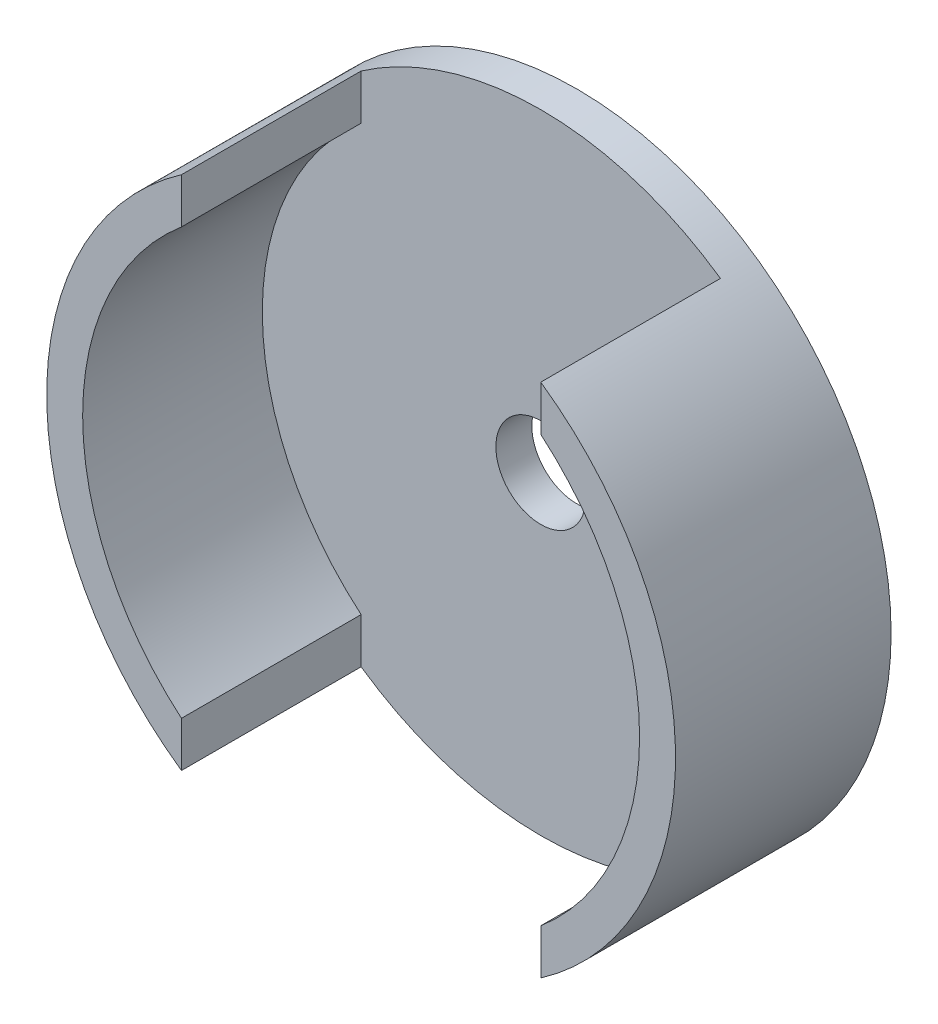
from build123d import *

# Parameters (mm, degrees)
SKETCH1_R               = 17.5
BOSS_EXTRUDE1_DEPTH     = 12
SHELL4_T                = -2
CUT_EXTRUDE1_DEPTH      = 28.504545079
CUT_EXTRUDE1_DEPTH_BACK = 28.504545079
SKETCH3_R               = 2.5
CUT_EXTRUDE2_DEPTH      = 28.504545079
CUT_EXTRUDE2_DEPTH_BACK = 28.504545079
SKETCH4_W               = 20
SKETCH4_H               = 24.94066955


with BuildPart() as part:
    # Sketch1 → Boss-Extrude1 (new body)
    with BuildSketch(Plane.XY):
        Circle(SKETCH1_R)
    extrude(amount=BOSS_EXTRUDE1_DEPTH)

    # Shell4
    shell4_openings = [part.faces().sort_by_distance(p)[0] for p in [
        (0, 0, 12),
    ]]
    offset(amount=SHELL4_T, openings=shell4_openings, kind=Kind.INTERSECTION)

    # Sketch3 → Cut-Extrude1 (cut, two sides: drawn at the far end of the back side and taken through both)
    with BuildSketch(Plane.XY.offset(-CUT_EXTRUDE1_DEPTH_BACK)):
        Circle(SKETCH3_R)
    extrude(amount=CUT_EXTRUDE1_DEPTH + CUT_EXTRUDE1_DEPTH_BACK, mode=Mode.SUBTRACT)

    # Sketch4 → Cut-Extrude2 (cut, two sides: drawn at the far end of the back side and taken through both)
    with BuildSketch(Plane(origin=(0, 0, 0), x_dir=(1, 0, 0), z_dir=(0, 1, 0)).offset(-CUT_EXTRUDE2_DEPTH_BACK)):
        with Locations((0, -14.470334775)):
            Rectangle(SKETCH4_W, SKETCH4_H)
    extrude(amount=CUT_EXTRUDE2_DEPTH + CUT_EXTRUDE2_DEPTH_BACK, mode=Mode.SUBTRACT)


solid = part.part
